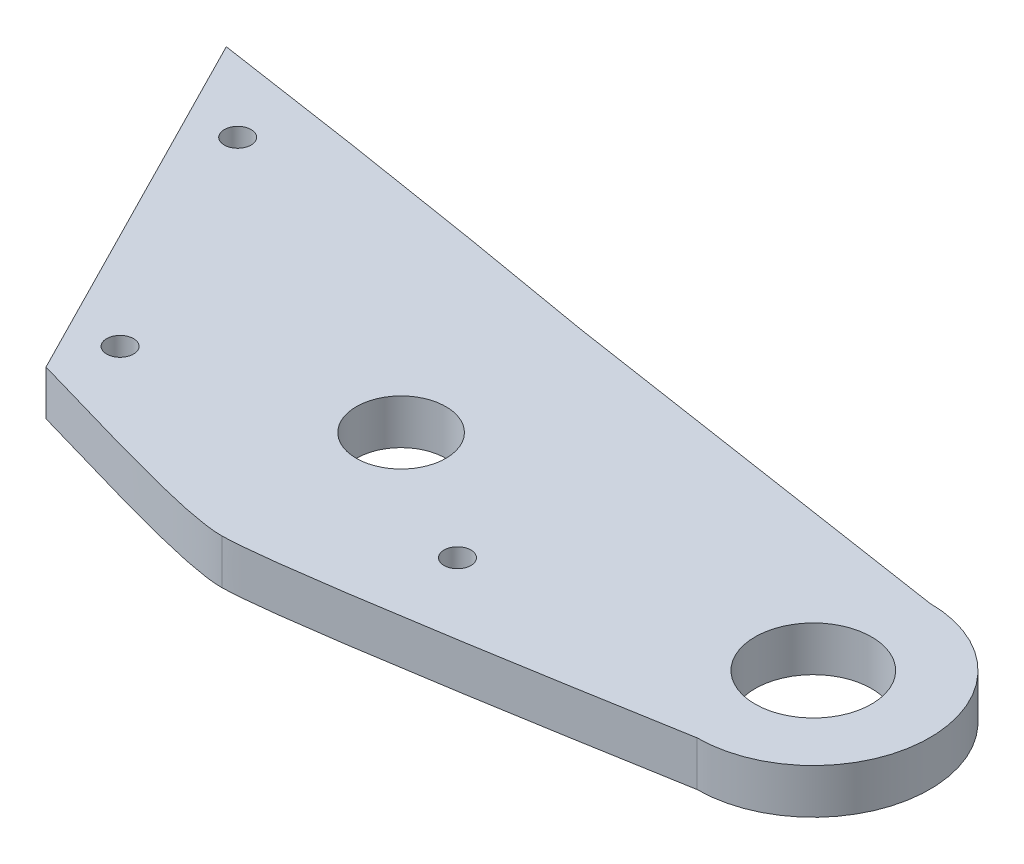
from build123d import *

# Parameters (mm, degrees)
BOSS_EXTRUDE1_DEPTH      = 20
BOSS_EXTRUDE1_DEPTH_BACK = 20
SKETCH1_R                = 5
SKETCH1_R_2              = 6.5
CUT_EXTRUDE4_DEPTH       = 35
SKETCH6_R                = 1.5
CUT_EXTRUDE5_DEPTH       = 10
CUT_EXTRUDE6_DEPTH       = 50


with BuildPart() as part:
    # Sketch1 → Boss-Extrude1 (new, two sides: drawn at the far end of the back side and taken through both)
    with BuildSketch(Plane(origin=(0, 0, 0), x_dir=(1, 0, 0), z_dir=(0, 1, 0)).offset(-BOSS_EXTRUDE1_DEPTH_BACK)):
        with BuildLine():
            ThreePointArc((-328.284271247, 28.284271247), (-328.284271247, -28.284271247), (-271.715728753, -28.284271247))
            add(Edge.make_bspline(
                [(-271.715728753, -28.284271247), (-189.219937614, 54.211519891), (-20, -20), (3.938998468, -20), (19.272331802, -17.666666667), (46, -13)],
                knots=[0, 0, 0, 0, 1, 1, 1.196949923, 1.196949923, 1.196949923, 1.196949923], degree=3))
            ThreePointArc((46, -13), (59, 0), (46, 13))
            add(Edge.make_bspline(
                [(46, 13), (0.03150303, 20), (0, 20)],
                knots=[0.358766717, 0.358766717, 0.358766717, 1.358766717, 1.358766717, 1.358766717], degree=2))
            add(Edge.make_bspline(
                [(0, 20), (-114.873131821, 40.378289836), (-300, 56.568542495), (-328.284271247, 28.284271247)],
                knots=[0.1900067, 0.1900067, 0.1900067, 0.1900067, 1.1900067, 1.1900067, 1.1900067, 1.1900067], degree=3))
        make_face()
        Circle(SKETCH1_R, mode=Mode.SUBTRACT)
        with Locations((46, 0)):
            Circle(SKETCH1_R_2, mode=Mode.SUBTRACT)
    extrude(amount=BOSS_EXTRUDE1_DEPTH + BOSS_EXTRUDE1_DEPTH_BACK)

    # Sketch5 → Cut-Extrude4 (cut)
    with BuildSketch(Plane(origin=(0, 20, 0), x_dir=(1, 0, 0), z_dir=(0, 1, 0))):
        Polygon((-47.037049996, 27.527548523), (92.120786702, 16.164640032), (85.724700256, -16.918764701), (-17.262768022, -30.907770073), align=None)
    extrude(amount=-CUT_EXTRUDE4_DEPTH, mode=Mode.SUBTRACT)

    # Sketch6 → Cut-Extrude5 (cut)
    with BuildSketch(Plane(origin=(0, -20, 0), x_dir=(-1, 0, 0), z_dir=(0, -1, 0))):
        with Locations((24.005160607, -7.356928903)):
            Circle(SKETCH6_R)
        with Locations((-15.251108102, -8.960330165)):
            Circle(SKETCH6_R)
        with Locations((37.643080162, 19.408995291)):
            Circle(SKETCH6_R)
    extrude(amount=-CUT_EXTRUDE5_DEPTH, mode=Mode.SUBTRACT)

    # Sketch7 → Cut-Extrude6 (cut)
    with BuildSketch(Plane(origin=(0, 20, 0), x_dir=(1, 0, 0), z_dir=(0, 1, 0))):
        Polygon((-47.037049996, 27.527548523), (-26.137658318, -13.489817144), (-379.595719096, -92.580220424), (-321.505561991, 137.254748988), align=None)
    extrude(amount=-CUT_EXTRUDE6_DEPTH, mode=Mode.SUBTRACT)


solid = part.part
